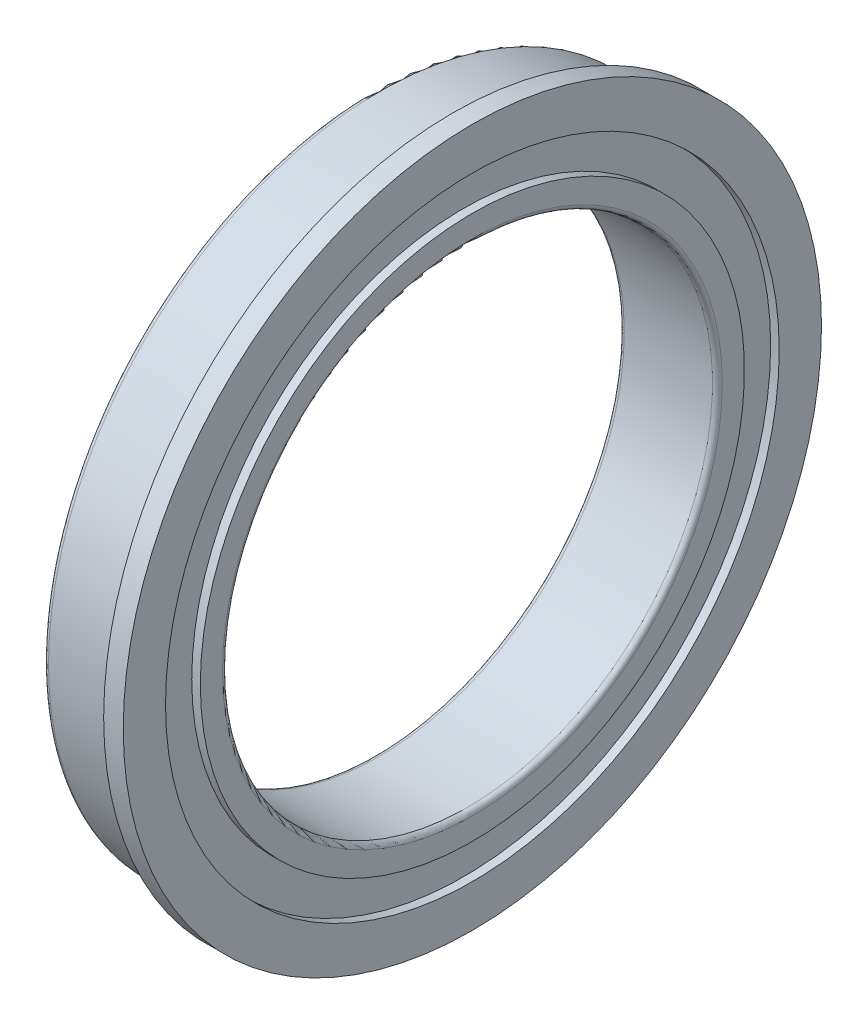
from build123d import *

# Parameters (mm, degrees)
FILLET1_R = 0.2


with BuildPart() as part:
    # Sketch1 → Revolve1 (revolve)
    with BuildSketch(Plane.XY, mode=Mode.PRIVATE) as revolve1_sk:
        with BuildLine():
            Line((0, 13.7), (0, 14.25))
            Line((0, 14.25), (0.8, 14.25))
            Line((0.8, 14.25), (0.8, 12.525))
            Line((0.8, 12.525), (0.45, 12.525))
            Line((0.45, 12.525), (0.45, 11.105))
            Line((0.45, 11.105), (0.8, 11.105))
            Line((0.8, 11.105), (0.8, 10))
            Line((0.8, 10), (-3.2, 10))
            Line((-3.2, 10), (-3.2, 11.105))
            Line((-3.2, 11.105), (-2.85, 11.105))
            Line((-2.85, 11.105), (-2.85, 12.525))
            Line((-2.85, 12.525), (-3.2, 12.525))
            Line((-3.2, 12.525), (-3.2, 13.5))
            Line((-3.2, 13.5), (-0.2, 13.5))
            ThreePointArc((-0.2, 13.5), (0.141421356, 13.358578644), (0, 13.7))
        make_face()
    revolve(revolve1_sk.sketch.rotate(Axis((-3.2, 0, 0), (1, 0, 0)), 90), axis=Axis((-3.2, 0, 0), (1, 0, 0)))

    # Fillet1
    fillet1_edges = [part.edges().sort_by_distance(p)[0] for p in [
        (0.8, 0, -10),
        (-3.2, 0, -10),
        (-3.2, 0, -13.5),
    ]]
    fillet(fillet1_edges, radius=FILLET1_R)


solid = part.part
